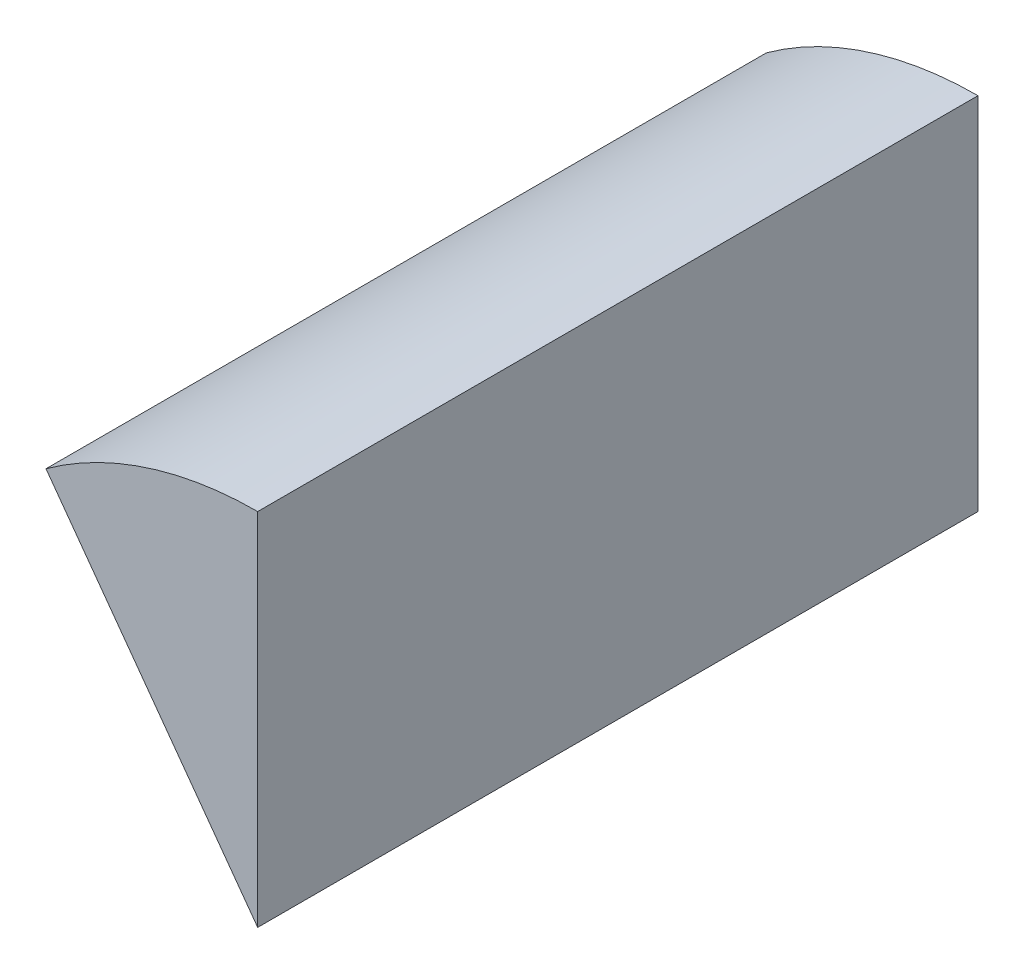
from build123d import *

# Parameters (mm, degrees)
SALIENTE_EXTRUIR1_DEPTH = 50
CROQUIS2_R              = 5
CORTAR_EXTRUIR1_DEPTH   = 10


with BuildPart() as part:
    # Croquis1 → Saliente-Extruir1 (new body)
    with BuildSketch(Plane.XY):
        with BuildLine():
            Line((0, 25), (0, 0))
            Line((0, 0), (-14.694631307, 20.225424859))
            ThreePointArc((-14.694631307, 20.225424859), (-7.725424859, 23.776412907), (0, 25))
        make_face()
    extrude(amount=SALIENTE_EXTRUIR1_DEPTH)

    # Croquis2 → Cortar-Extruir1 (cut)
    with BuildSketch(Plane(origin=(0, 0, 0), x_dir=(-1, 0, 0), z_dir=(0, 0, -1))):
        with Locations((5.825690748, 18.377276196)):
            Circle(CROQUIS2_R)
    extrude(amount=-CORTAR_EXTRUIR1_DEPTH, mode=Mode.SUBTRACT)


solid = part.part
